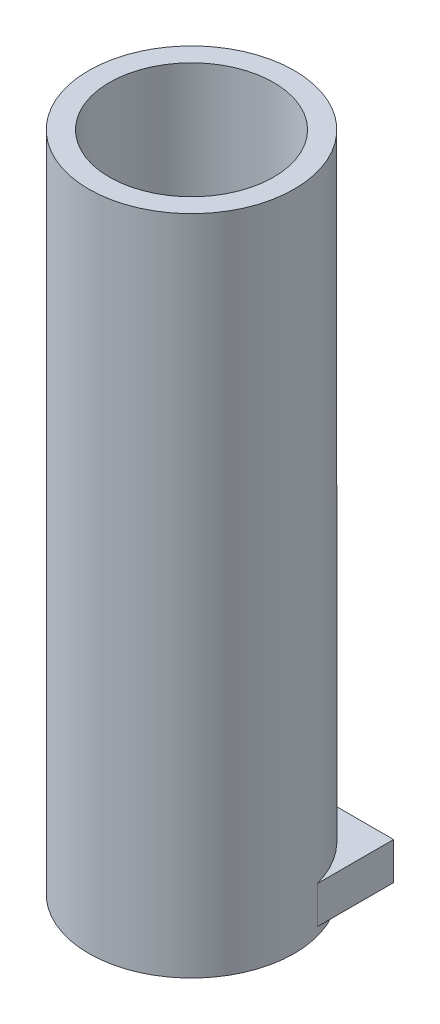
from build123d import *

# Parameters (mm, degrees)
SKETCH1_R                = 12.4187
BOSS_EXTRUDE1_DEPTH      = 80
SKETCH1_3_R              = 9.9187
CUT_EXTRUDE1_DEPTH       = 20
BOSS_EXTRUDE2_REACH      = 86.682
BOSS_EXTRUDE2_END_RADIUS = 12.4187
SKETCH2_W                = 24
SKETCH2_H                = 4.51281607
SKETCH3_R                = 0.6
CUT_EXTRUDE2_DEPTH       = 10


with BuildPart() as part:
    # Sketch1 → Boss-Extrude1 (new body)
    with BuildSketch(Plane(origin=(0, 0, 0), x_dir=(1, 0, 0), z_dir=(0, 1, 0))):
        Circle(SKETCH1_R)
    extrude(amount=-BOSS_EXTRUDE1_DEPTH)

    # Sketch1<3> → Cut-Extrude1 (cut)
    with BuildSketch(Plane(origin=(0, 0, 0), x_dir=(1, 0, 0), z_dir=(0, 1, 0))):
        Circle(SKETCH1_3_R)
    extrude(amount=-CUT_EXTRUDE1_DEPTH, mode=Mode.SUBTRACT)

    # Boss-Extrude2: up to this cylinder (the profile starts outside it)
    boss_extrude2_end = Plane(origin=(0, -76.743592, 0), z_dir=(0, 1, 0)) * Cylinder(BOSS_EXTRUDE2_END_RADIUS, 199.2014, mode=Mode.PRIVATE)
    # Sketch2 → Boss-Extrude2 (add, up to the surface)
    with BuildSketch(Plane.XY.offset(-12.4187), mode=Mode.PRIVATE) as boss_extrude2_sk1:
        with Locations((0, -76.743591965)):
            Rectangle(SKETCH2_W, SKETCH2_H)
    boss_extrude2_tool1 = extrude(boss_extrude2_sk1.sketch, amount=BOSS_EXTRUDE2_REACH, mode=Mode.PRIVATE) - boss_extrude2_end
    add(boss_extrude2_tool1.solids().sort_by_distance((0, -76.743592, -12.4187))[0])
    add(boss_extrude2_tool1.solids().sort_by_distance((0, -76.743592, -12.4187))[1])

    # Sketch3 → Cut-Extrude2 (cut)
    with BuildSketch(Plane(origin=(0, 0, -12.4187), x_dir=(-1, 0, 0), z_dir=(0, 0, -1))):
        with Locations((-4.45, -76.743591965)):
            Circle(SKETCH3_R)
        with Locations((-6.45, -76.743591965)):
            Circle(SKETCH3_R)
        with Locations((-8.45, -76.743591965)):
            Circle(SKETCH3_R)
        with Locations((-10.45, -76.743591965)):
            Circle(SKETCH3_R)
        with Locations((10.45, -76.743591965)):
            Circle(SKETCH3_R)
        with Locations((8.45, -76.743591965)):
            Circle(SKETCH3_R)
        with Locations((6.45, -76.743591965)):
            Circle(SKETCH3_R)
        with Locations((4.45, -76.743591965)):
            Circle(SKETCH3_R)
    extrude(amount=-CUT_EXTRUDE2_DEPTH, mode=Mode.SUBTRACT)


solid = part.part
